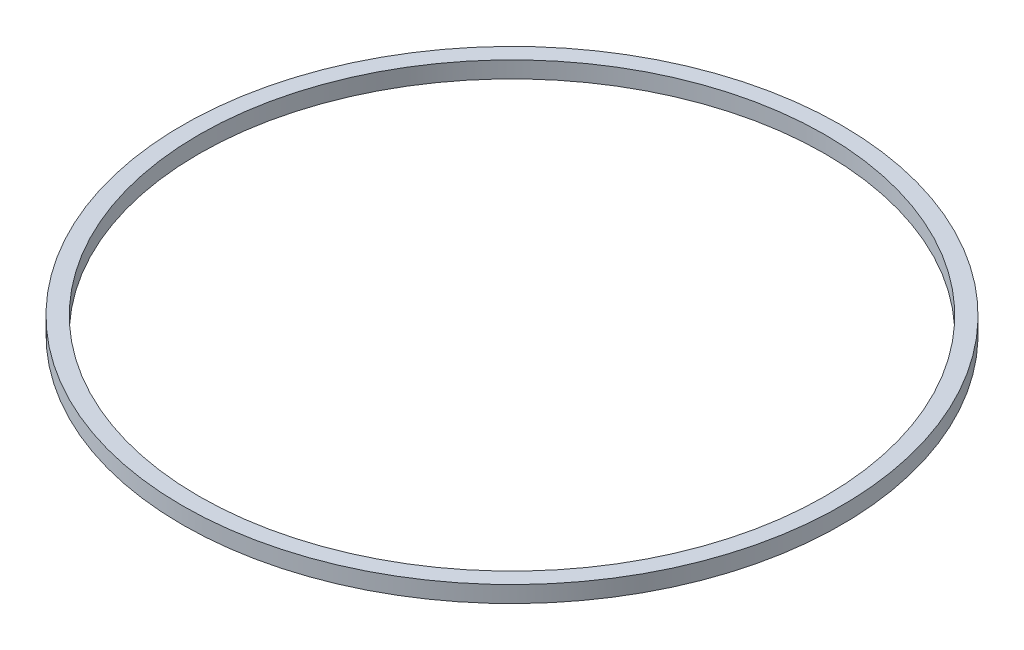
from build123d import *

# Parameters (mm, degrees)
SKETCH1_R           = 200
BOSS_EXTRUDE1_DEPTH = 10
SKETCH2_R           = 190
CUT_EXTRUDE1_DEPTH  = 284.019433962


with BuildPart() as part:
    # Sketch1 → Boss-Extrude1 (new body)
    with BuildSketch(Plane(origin=(0, 0, 0), x_dir=(1, 0, 0), z_dir=(0, 1, 0))):
        with Locations(Location((0, 0, 0), (0, 0, 270))):
            Circle(SKETCH1_R)
    extrude(amount=BOSS_EXTRUDE1_DEPTH)

    # Sketch2 → Cut-Extrude1 (cut, through all)
    with BuildSketch(Plane(origin=(0, 10, 0), x_dir=(1, 0, 0), z_dir=(0, 1, 0))):
        with Locations(Location((0, 0, 0), (0, 0, 270))):
            Circle(SKETCH2_R)
    extrude(amount=-CUT_EXTRUDE1_DEPTH, mode=Mode.SUBTRACT)


solid = part.part
